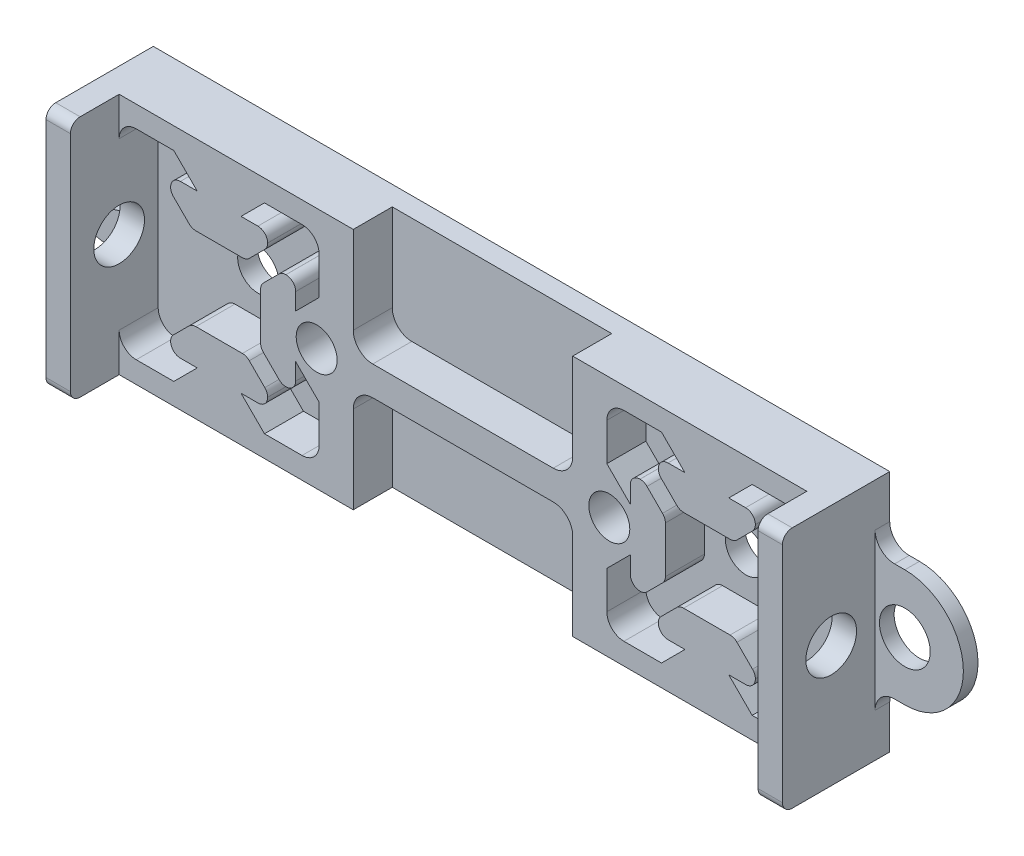
from build123d import *

# Parameters (mm, degrees)
SKETCH1_W           = 75.5
SKETCH1_H           = 24.9
BOSS_EXTRUDE1_DEPTH = 4
SKETCH2_W           = 75.5
SKETCH2_H           = 24.9
BOSS_EXTRUDE2_DEPTH = 2
SKETCH3_W           = 22.5
SKETCH3_H           = 24.9
CUT_EXTRUDE1_DEPTH  = 4
FILLET1_R           = 1
SKETCH4_R           = 2.1
CUT_EXTRUDE2_DEPTH  = 65.098655819
SKETCH5_W           = 2.5
SKETCH5_H           = 24.9
BOSS_EXTRUDE3_DEPTH = 5
SKETCH8_R           = 2.6
CUT_EXTRUDE4_DEPTH  = 2.5
SKETCH9_R           = 2.6
CUT_EXTRUDE5_DEPTH  = 2.5
SKETCH10_R          = 2.1
CUT_EXTRUDE6_DEPTH  = 65.912538679
CUT_EXTRUDE7_DEPTH  = 4
SKETCH11_W          = 22.5
SKETCH11_H          = 3
BOSS_EXTRUDE4_DEPTH = 4
FILLET2_R           = 2
FILLET3_R           = 1
SKETCH12_R          = 2.6
BOSS_EXTRUDE5_DEPTH = 1.5
FILLET4_R           = 2


with BuildPart() as part:
    # Sketch1 → Boss-Extrude1 (new body)
    with BuildSketch(Plane.XY):
        with Locations((25, -0.002918444)):
            Rectangle(SKETCH1_W, SKETCH1_H)
        with BuildLine():
            Line((-6.428553391, 4.975), (-4.25, 2.796446609))
            Line((-4.25, 2.796446609), (-4.25, -2.796446609))
            Line((-4.25, -2.796446609), (-6.428553391, -4.975))
            Line((-6.428553391, -4.975), (-7.85, -4.975))
            Line((-7.85, -4.975), (-7.85, -2.246446609))
            Line((-7.85, -2.246446609), (-10.25, -4.646446609))
            Line((-10.25, -4.646446609), (-10.25, -8.5))
            ThreePointArc((-10.25, -8.5), (-9.737436867, -9.737436867), (-8.5, -10.25))
            Line((-8.5, -10.25), (-4.646446609, -10.25))
            Line((-4.646446609, -10.25), (-2.246446609, -7.85))
            Line((-2.246446609, -7.85), (-4.975, -7.85))
            Line((-4.975, -7.85), (-4.975, -6.428553391))
            Line((-4.975, -6.428553391), (-2.796446609, -4.25))
            Line((-2.796446609, -4.25), (2.796446609, -4.25))
            Line((2.796446609, -4.25), (4.975, -6.428553391))
            Line((4.975, -6.428553391), (4.975, -7.85))
            Line((4.975, -7.85), (2.246446609, -7.85))
            Line((2.246446609, -7.85), (4.646446609, -10.25))
            Line((4.646446609, -10.25), (8.5, -10.25))
            ThreePointArc((8.5, -10.25), (9.737436867, -9.737436867), (10.25, -8.5))
            Line((10.25, -8.5), (10.25, -4.646446609))
            Line((10.25, -4.646446609), (7.85, -2.246446609))
            Line((7.85, -2.246446609), (7.85, -4.975))
            Line((7.85, -4.975), (6.428553391, -4.975))
            Line((6.428553391, -4.975), (4.25, -2.796446609))
            Line((4.25, -2.796446609), (4.25, 2.796446609))
            Line((4.25, 2.796446609), (6.428553391, 4.975))
            Line((6.428553391, 4.975), (7.85, 4.975))
            Line((7.85, 4.975), (7.85, 2.246446609))
            Line((7.85, 2.246446609), (10.25, 4.646446609))
            Line((10.25, 4.646446609), (10.25, 8.5))
            ThreePointArc((10.25, 8.5), (9.737436867, 9.737436867), (8.5, 10.25))
            Line((8.5, 10.25), (4.646446609, 10.25))
            Line((4.646446609, 10.25), (2.246446609, 7.85))
            Line((2.246446609, 7.85), (4.975, 7.85))
            Line((4.975, 7.85), (4.975, 6.428553391))
            Line((4.975, 6.428553391), (2.796446609, 4.25))
            Line((2.796446609, 4.25), (-2.796446609, 4.25))
            Line((-2.796446609, 4.25), (-4.975, 6.428553391))
            Line((-4.975, 6.428553391), (-4.975, 7.85))
            Line((-4.975, 7.85), (-2.246446609, 7.85))
            Line((-2.246446609, 7.85), (-4.646446609, 10.25))
            Line((-4.646446609, 10.25), (-8.5, 10.25))
            ThreePointArc((-8.5, 10.25), (-9.737436867, 9.737436867), (-10.25, 8.5))
            Line((-10.25, 8.5), (-10.25, 4.646446609))
            Line((-10.25, 4.646446609), (-7.85, 2.246446609))
            Line((-7.85, 2.246446609), (-7.85, 4.975))
            Line((-7.85, 4.975), (-6.428553391, 4.975))
        make_face(mode=Mode.SUBTRACT)
        with BuildLine():
            Line((57.85, 4.975), (56.428553391, 4.975))
            Line((56.428553391, 4.975), (54.25, 2.796446609))
            Line((54.25, 2.796446609), (54.25, -2.796446609))
            Line((54.25, -2.796446609), (56.428553391, -4.975))
            Line((56.428553391, -4.975), (57.85, -4.975))
            Line((57.85, -4.975), (57.85, -2.246446609))
            Line((57.85, -2.246446609), (60.25, -4.646446609))
            Line((60.25, -4.646446609), (60.25, -8.5))
            ThreePointArc((60.25, -8.5), (59.737436867, -9.737436867), (58.5, -10.25))
            Line((58.5, -10.25), (54.646446609, -10.25))
            Line((54.646446609, -10.25), (52.246446609, -7.85))
            Line((52.246446609, -7.85), (54.975, -7.85))
            Line((54.975, -7.85), (54.975, -6.428553391))
            Line((54.975, -6.428553391), (52.796446609, -4.25))
            Line((52.796446609, -4.25), (47.203553391, -4.25))
            Line((47.203553391, -4.25), (45.025, -6.428553391))
            Line((45.025, -6.428553391), (45.025, -7.85))
            Line((45.025, -7.85), (47.753553391, -7.85))
            Line((47.753553391, -7.85), (45.353553391, -10.25))
            Line((45.353553391, -10.25), (41.5, -10.25))
            ThreePointArc((41.5, -10.25), (40.262563133, -9.737436867), (39.75, -8.5))
            Line((39.75, -8.5), (39.75, -4.646446609))
            Line((39.75, -4.646446609), (42.15, -2.246446609))
            Line((42.15, -2.246446609), (42.15, -4.975))
            Line((42.15, -4.975), (43.571446609, -4.975))
            Line((43.571446609, -4.975), (45.75, -2.796446609))
            Line((45.75, -2.796446609), (45.75, 2.796446609))
            Line((45.75, 2.796446609), (43.571446609, 4.975))
            Line((43.571446609, 4.975), (42.15, 4.975))
            Line((42.15, 4.975), (42.15, 2.246446609))
            Line((42.15, 2.246446609), (39.75, 4.646446609))
            Line((39.75, 4.646446609), (39.75, 8.5))
            ThreePointArc((39.75, 8.5), (40.262563133, 9.737436867), (41.5, 10.25))
            Line((41.5, 10.25), (45.353553391, 10.25))
            Line((45.353553391, 10.25), (47.753553391, 7.85))
            Line((47.753553391, 7.85), (45.025, 7.85))
            Line((45.025, 7.85), (45.025, 6.428553391))
            Line((45.025, 6.428553391), (47.203553391, 4.25))
            Line((47.203553391, 4.25), (52.796446609, 4.25))
            Line((52.796446609, 4.25), (54.975, 6.428553391))
            Line((54.975, 6.428553391), (54.975, 7.85))
            Line((54.975, 7.85), (52.246446609, 7.85))
            Line((52.246446609, 7.85), (54.646446609, 10.25))
            Line((54.646446609, 10.25), (58.5, 10.25))
            ThreePointArc((58.5, 10.25), (59.737436867, 9.737436867), (60.25, 8.5))
            Line((60.25, 8.5), (60.25, 4.646446609))
            Line((60.25, 4.646446609), (57.85, 2.246446609))
            Line((57.85, 2.246446609), (57.85, 4.975))
        make_face(mode=Mode.SUBTRACT)
    extrude(amount=BOSS_EXTRUDE1_DEPTH)

    # Sketch2 → Boss-Extrude2 (add)
    with BuildSketch(Plane(origin=(0, 0, 0), x_dir=(-1, 0, 0), z_dir=(0, 0, -1))):
        with Locations((-25, -0.002918444)):
            Rectangle(SKETCH2_W, SKETCH2_H)
    extrude(amount=BOSS_EXTRUDE2_DEPTH)

    # Sketch3 → Cut-Extrude1 (cut)
    with BuildSketch(Plane.XY.offset(4)):
        with Locations((25, -0.002918444)):
            Rectangle(SKETCH3_W, SKETCH3_H)
    extrude(amount=-CUT_EXTRUDE1_DEPTH, mode=Mode.SUBTRACT)

    # Fillet1
    fillet1_edges = [part.edges().sort_by_distance(p)[0] for p in [
        (-7.85, 4.975, 2),
        (-6.428553391, 4.975, 2),
        (-4.25, 2.796446609, 2),
        (-4.25, -2.796446609, 2),
        (-6.428553391, -4.975, 2),
        (-7.85, -4.975, 2),
        (-4.975, -7.85, 2),
        (-4.975, -6.428553391, 2),
        (-2.796446609, -4.25, 2),
        (2.796446609, -4.25, 2),
        (4.975, -6.428553391, 2),
        (4.975, -7.85, 2),
        (7.85, -4.975, 2),
        (6.428553391, -4.975, 2),
        (4.25, -2.796446609, 2),
        (4.25, 2.796446609, 2),
        (6.428553391, 4.975, 2),
        (7.85, 4.975, 2),
        (4.975, 7.85, 2),
        (4.975, 6.428553391, 2),
        (2.796446609, 4.25, 2),
        (-2.796446609, 4.25, 2),
        (-4.975, 6.428553391, 2),
        (-4.975, 7.85, 2),
        (57.85, -4.975, 2),
        (56.428553391, -4.975, 2),
        (54.25, -2.796446609, 2),
        (54.25, 2.796446609, 2),
        (56.428553391, 4.975, 2),
        (57.85, 4.975, 2),
        (54.975, 7.85, 2),
        (54.975, 6.428553391, 2),
        (52.796446609, 4.25, 2),
        (47.203553391, 4.25, 2),
        (45.025, 6.428553391, 2),
        (45.025, 7.85, 2),
        (42.15, 4.975, 2),
        (43.571446609, 4.975, 2),
        (45.75, 2.796446609, 2),
        (45.75, -2.796446609, 2),
        (43.571446609, -4.975, 2),
        (42.15, -4.975, 2),
        (45.025, -7.85, 2),
        (45.025, -6.428553391, 2),
        (47.203553391, -4.25, 2),
        (52.796446609, -4.25, 2),
        (54.975, -6.428553391, 2),
        (54.975, -7.85, 2),
    ]]
    fillet(fillet1_edges, radius=FILLET1_R)

    # Sketch4 → Cut-Extrude2 (cut, through all)
    with BuildSketch(Plane.XY):
        Circle(SKETCH4_R)
        with Locations(Location((50, 0, 0), (0, 0, 180))):
            Circle(SKETCH4_R)
    extrude(amount=-CUT_EXTRUDE2_DEPTH, mode=Mode.SUBTRACT)

    # Sketch5 → Boss-Extrude3 (add)
    with BuildSketch(Plane.XY.offset(4)):
        with Locations((-11.5, -0.002918444)):
            Rectangle(SKETCH5_W, SKETCH5_H)
        with Locations((61.5, -0.002918444)):
            Rectangle(SKETCH5_W, SKETCH5_H)
    extrude(amount=BOSS_EXTRUDE3_DEPTH)

    # Sketch8 → Cut-Extrude4 (cut)
    with BuildSketch(Plane(origin=(62.75, 0, 0), x_dir=(0, 0, -1), z_dir=(1, 0, 0))):
        with Locations((-4, -0.002918444)):
            Circle(SKETCH8_R)
    extrude(amount=-CUT_EXTRUDE4_DEPTH, mode=Mode.SUBTRACT)

    # Sketch9 → Cut-Extrude5 (cut)
    with BuildSketch(Plane.ZY.offset(12.75)):
        with Locations(Location((4, 0, 0), (0, 0, 270))):
            Circle(SKETCH9_R)
    extrude(amount=-CUT_EXTRUDE5_DEPTH, mode=Mode.SUBTRACT)

    # Sketch10 → Cut-Extrude6 (cut, through all)
    with BuildSketch(Plane(origin=(0, 0, -2), x_dir=(-1, 0, 0), z_dir=(0, 0, -1))):
        with Locations((-10, 0)):
            Circle(SKETCH10_R)
        with Locations(Location((-40, 0, 0), (0, 0, 180))):
            Circle(SKETCH10_R)
    extrude(amount=-CUT_EXTRUDE6_DEPTH, mode=Mode.SUBTRACT)

    # Sketch7 → Cut-Extrude7 (cut)
    with BuildSketch(Plane.XY.offset(4)):
        with BuildLine():
            Line((-7.85, 2.246446609), (-10.25, 4.646446609))
            Line((-10.25, 4.646446609), (-10.25, -4.646446609))
            Line((-10.25, -4.646446609), (-7.85, -2.246446609))
            Line((-7.85, -2.246446609), (-7.85, -3.975))
            ThreePointArc((-7.85, -3.975), (-7.557106781, -4.682106781), (-6.85, -4.975))
            Line((-6.85, -4.975), (-6.842766953, -4.975))
            ThreePointArc((-6.842766953, -4.975), (-6.460083521, -4.898879533), (-6.135660172, -4.682106781))
            Line((-6.135660172, -4.682106781), (-4.542893219, -3.089339828))
            ThreePointArc((-4.542893219, -3.089339828), (-4.326120467, -2.764916479), (-4.25, -2.382233047))
            Line((-4.25, -2.382233047), (-4.25, 2.382233047))
            ThreePointArc((-4.25, 2.382233047), (-4.326120467, 2.764916479), (-4.542893219, 3.089339828))
            Line((-4.542893219, 3.089339828), (-6.135660172, 4.682106781))
            ThreePointArc((-6.135660172, 4.682106781), (-6.460083521, 4.898879533), (-6.842766953, 4.975))
            Line((-6.842766953, 4.975), (-6.85, 4.975))
            ThreePointArc((-6.85, 4.975), (-7.557106781, 4.682106781), (-7.85, 3.975))
            Line((-7.85, 3.975), (-7.85, 2.246446609))
        make_face()
        with BuildLine():
            Line((57.85, -2.246446609), (60.25, -4.646446609))
            Line((60.25, -4.646446609), (60.25, 4.646446609))
            Line((60.25, 4.646446609), (57.85, 2.246446609))
            Line((57.85, 2.246446609), (57.85, 3.975))
            ThreePointArc((57.85, 3.975), (57.557106781, 4.682106781), (56.85, 4.975))
            Line((56.85, 4.975), (56.842766953, 4.975))
            ThreePointArc((56.842766953, 4.975), (56.460083521, 4.898879533), (56.135660172, 4.682106781))
            Line((56.135660172, 4.682106781), (54.542893219, 3.089339828))
            ThreePointArc((54.542893219, 3.089339828), (54.326120467, 2.764916479), (54.25, 2.382233047))
            Line((54.25, 2.382233047), (54.25, -2.382233047))
            ThreePointArc((54.25, -2.382233047), (54.326120467, -2.764916479), (54.542893219, -3.089339828))
            Line((54.542893219, -3.089339828), (56.135660172, -4.682106781))
            ThreePointArc((56.135660172, -4.682106781), (56.460083521, -4.898879533), (56.842766953, -4.975))
            Line((56.842766953, -4.975), (56.85, -4.975))
            ThreePointArc((56.85, -4.975), (57.557106781, -4.682106781), (57.85, -3.975))
            Line((57.85, -3.975), (57.85, -2.246446609))
        make_face()
    extrude(amount=-CUT_EXTRUDE7_DEPTH, mode=Mode.SUBTRACT)

    # Sketch11 → Boss-Extrude4 (add)
    with BuildSketch(Plane.XY):
        with Locations((25, -0.002918444)):
            Rectangle(SKETCH11_W, SKETCH11_H)
    extrude(amount=BOSS_EXTRUDE4_DEPTH)

    # Fillet2
    fillet2_edges = [part.edges().sort_by_distance(p)[0] for p in [
        (13.75, 1.497081556, 2),
        (13.75, -1.502918444, 2),
        (36.25, -1.502918444, 2),
        (36.25, 1.497081556, 2),
    ]]
    fillet(fillet2_edges, radius=FILLET2_R)

    # Fillet3
    fillet3_edges = [part.edges().sort_by_distance(p)[0] for p in [
        (-11.5, -12.452918444, 9),
        (-11.5, 12.447081556, 9),
        (61.5, 12.447081556, 9),
        (61.5, -12.452918444, 9),
    ]]
    fillet(fillet3_edges, radius=FILLET3_R)

    # Sketch12 → Boss-Extrude5 (add)
    # profile 1 of 2: a face of its own
    with BuildSketch(Plane(origin=(0, 0, -2), x_dir=(-1, 0, 0), z_dir=(0, 0, -1))):
        with BuildLine():
            Line((12.75, -6), (15.8, -6))
            ThreePointArc((15.8, -6), (21.8, 0), (15.8, 6))
            Line((15.8, 6), (12.75, 6))
            Line((12.75, 6), (12.75, -6))
        make_face()
        with Locations((15.8, 0)):
            Circle(SKETCH12_R, mode=Mode.SUBTRACT)
    # profile 2 of 2: a face of its own
    with BuildSketch(Plane(origin=(0, 0, -2), x_dir=(-1, 0, 0), z_dir=(0, 0, -1))):
        with BuildLine():
            Line((-65.8, -6), (-62.75, -6))
            Line((-62.75, -6), (-62.75, 6))
            Line((-62.75, 6), (-65.8, 6))
            ThreePointArc((-65.8, 6), (-71.8, 0), (-65.8, -6))
        make_face()
        with Locations((-65.8, 0)):
            Circle(SKETCH12_R, mode=Mode.SUBTRACT)
    extrude(amount=-BOSS_EXTRUDE5_DEPTH)

    # Fillet4
    fillet4_edges = [part.edges().sort_by_distance(p)[0] for p in [
        (-12.75, -6, -1.25),
        (-12.75, 6, -1.25),
        (62.75, 6, -1.25),
        (62.75, -6, -1.25),
    ]]
    fillet(fillet4_edges, radius=FILLET4_R)


solid = part.part
